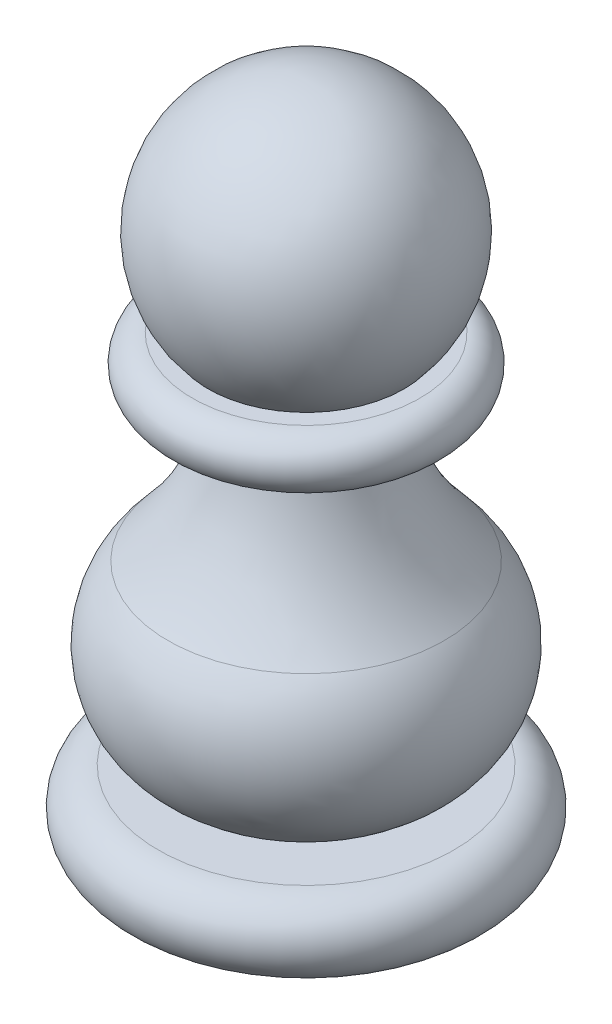
from build123d import *


with BuildPart() as part:
    # Sketch3 → Revolve1 (revolve)
    with BuildSketch(Plane.XY, mode=Mode.PRIVATE) as revolve1_sk:
        with BuildLine():
            Line((-5.590169944, 25.5), (-6.5, 25.5))
            ThreePointArc((-6.5, 25.5), (-8, 24), (-6.5, 22.5))
            Line((-6.5, 22.5), (-4, 22.5))
            ThreePointArc((-4, 22.5), (-5.297114623, 18.046406572), (-7.892885737, 14.202063572))
            ThreePointArc((-7.892885737, 14.202063572), (-9, 7.719789286), (-3.499252929, 4.115990794))
            Line((-3.499252929, 4.115990794), (-8.442004603, 4.115990794))
            ThreePointArc((-8.442004603, 4.115990794), (-10.5, 2.057995397), (-8.442004603, 0))
            Line((-8.442004603, 0), (0, 0))
            Line((0, 0), (0, 38))
            ThreePointArc((0, 38), (-6.846531969, 33.561862178), (-5.590169944, 25.5))
        make_face()
    revolve(revolve1_sk.sketch.rotate(Axis((0, 0, 0), (0, 1, 0)), 270), axis=Axis((0, 0, 0), (0, 1, 0)))


solid = part.part
